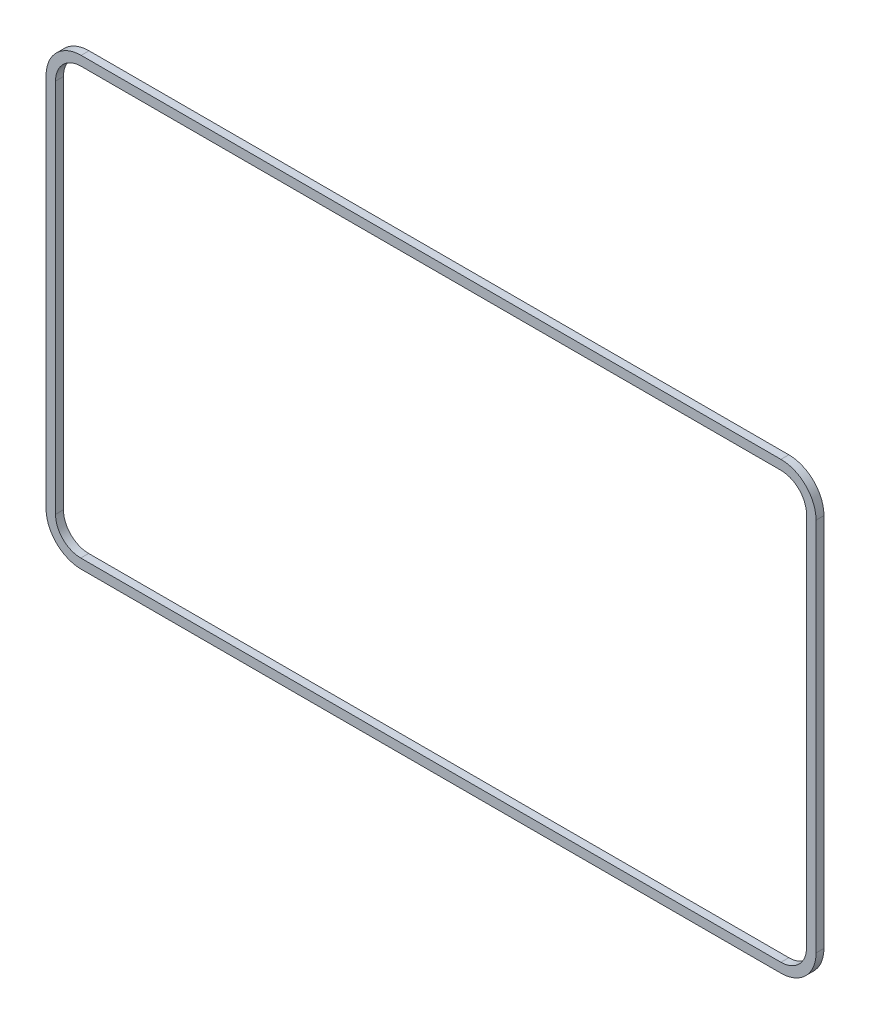
from build123d import *

# Parameters (mm, degrees)
BOSS_EXTRUDE1_DEPTH = 2


with BuildPart() as part:
    # Sketch1 → Boss-Extrude1 (new body)
    with BuildSketch(Plane.XY):
        with BuildLine():
            Line((88.5, -56.28), (-88.5, -56.28))
            ThreePointArc((-88.5, -56.28), (-94.779108217, -53.679108217), (-97.38, -47.4))
            Line((-97.38, -47.4), (-97.38, 47.4))
            ThreePointArc((-97.38, 47.4), (-94.779108217, 53.679108217), (-88.5, 56.28))
            Line((-88.5, 56.28), (88.5, 56.28))
            ThreePointArc((88.5, 56.28), (94.779108217, 53.679108217), (97.38, 47.4))
            Line((97.38, 47.4), (97.38, -47.4))
            ThreePointArc((97.38, -47.4), (94.779108217, -53.679108217), (88.5, -56.28))
        make_face()
        with BuildLine():
            Line((88.5, -53.88), (-88.6, -53.88))
            ThreePointArc((-88.6, -53.88), (-93.111341264, -52.011341264), (-94.98, -47.5))
            Line((-94.98, -47.5), (-94.98, 47.4))
            ThreePointArc((-94.98, 47.4), (-93.082051942, 51.982051942), (-88.5, 53.88))
            Line((-88.5, 53.88), (88.5, 53.88))
            ThreePointArc((88.5, 53.88), (93.082051942, 51.982051942), (94.98, 47.4))
            Line((94.98, 47.4), (94.98, -47.4))
            ThreePointArc((94.98, -47.4), (93.082051942, -51.982051942), (88.5, -53.88))
        make_face(mode=Mode.SUBTRACT)
    extrude(amount=BOSS_EXTRUDE1_DEPTH)


solid = part.part
